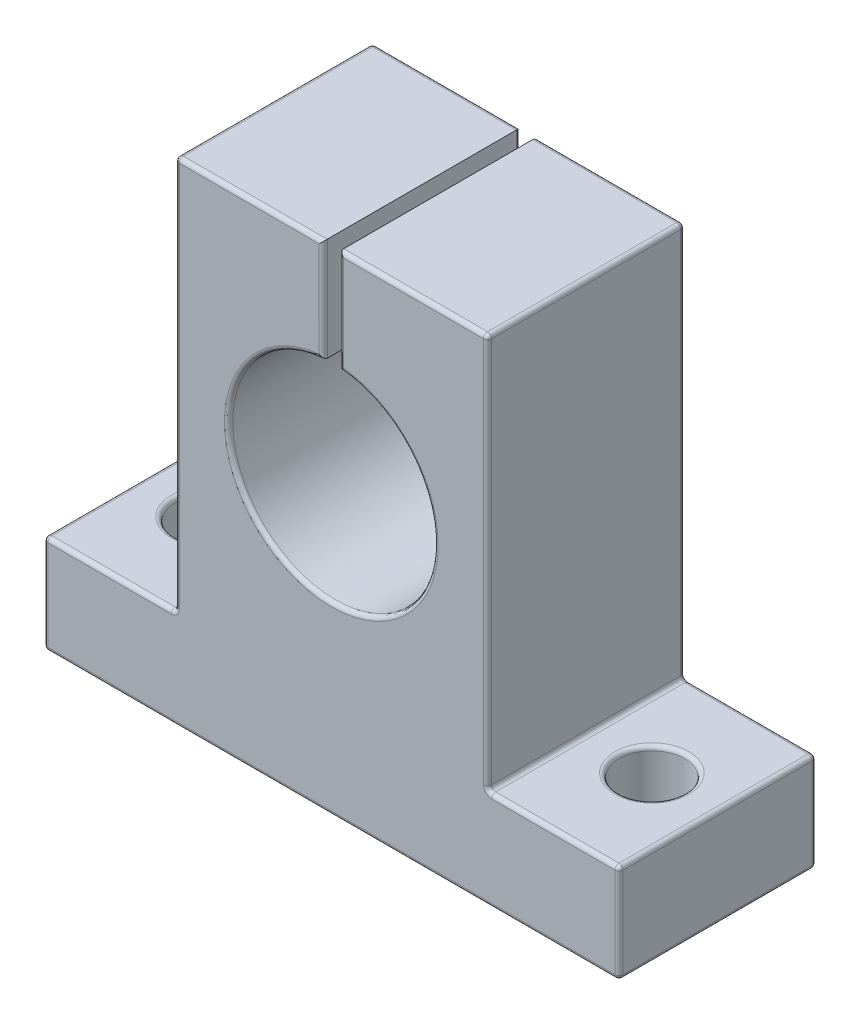
from build123d import *

# Parameters (mm, degrees)
DODANIE_WYCI_GNI_CIE1_DEPTH      = 12
DODANIE_WYCI_GNI_CIE1_DEPTH_BACK = 12
WYTNIJ_WYCI_GNI_CIE1_REACH       = 62.605
SZKIC2_R                         = 4
ZAOKR_GLENIE1_R                  = 0.5


with BuildPart() as part:
    # Szkic1 → Dodanie-wyciągnięcie1 (new, two sides: drawn at the far end of the back side and taken through both)
    with BuildSketch(Plane.XY.offset(-DODANIE_WYCI_GNI_CIE1_DEPTH_BACK)):
        with BuildLine():
            Line((19, 25), (19, -23))
            Line((19, -23), (35, -23))
            Line((35, -23), (35, -35))
            Line((35, -35), (-35, -35))
            Line((-35, -35), (-35, -23))
            Line((-35, -23), (-19, -23))
            Line((-19, -23), (-19, 25))
            Line((-19, 25), (-1, 25))
            Line((-1, 25), (-1, 12.459935794))
            ThreePointArc((-1, 12.459935794), (0, -12.5), (1, 12.459935794))
            Line((1, 12.459935794), (1, 25))
            Line((1, 25), (19, 25))
        make_face()
    extrude(amount=DODANIE_WYCI_GNI_CIE1_DEPTH + DODANIE_WYCI_GNI_CIE1_DEPTH_BACK)

    # Szkic2 → Wytnij-wyciągnięcie1 (cut, up to next)
    with BuildSketch(Plane(origin=(0, -23, 0), x_dir=(1, 0, 0), z_dir=(0, 1, 0)), mode=Mode.PRIVATE) as wytnij_wyci_gni_cie1_sk1:
        with Locations((27, 0)):
            Circle(SZKIC2_R)
    wytnij_wyci_gni_cie1_tool1 = extrude(wytnij_wyci_gni_cie1_sk1.sketch, amount=-WYTNIJ_WYCI_GNI_CIE1_REACH, mode=Mode.PRIVATE) & part.part
    wytnij_wyci_gni_cie1 = wytnij_wyci_gni_cie1_tool1.solids().sort_by_distance((27, -23, 0))[0]
    add(wytnij_wyci_gni_cie1, mode=Mode.SUBTRACT)

    # Lustro1: Wytnij-wyciągnięcie1 across plane
    add(wytnij_wyci_gni_cie1.mirror(Plane(origin=(0, 0, 0), x_dir=(0, 0, 1), z_dir=(1, 0, 0))), mode=Mode.SUBTRACT)

    # Zaokrąglenie1
    zaokr_glenie1_edges = [part.edges().sort_by_distance(p)[0] for p in [
        (-35, -35, 0),
        (-19, 25, 0),
        (-19, -23, 0),
        (-35, -23, 0),
        (-23, -23, 0),
        (10, 25, -12),
        (1, 18.729967897, -12),
        (0, -12.5, -12),
        (-1, 18.729967897, -12),
        (-10, 25, -12),
        (-19, 1, -12),
        (-27, -23, -12),
        (-35, -29, -12),
        (0, -35, -12),
        (35, -29, -12),
        (35, -35, 0),
        (27, -23, -12),
        (35, -23, 0),
        (23, -23, 0),
        (19, 1, -12),
        (19, -23, 0),
        (19, 25, 0),
        (-35, -29, 12),
        (-27, -23, 12),
        (-19, 1, 12),
        (-10, 25, 12),
        (-1, 18.729967897, 12),
        (0, -12.5, 12),
        (1, 18.729967897, 12),
        (10, 25, 12),
        (19, 1, 12),
        (27, -23, 12),
        (35, -29, 12),
        (0, -35, 12),
    ]]
    fillet(zaokr_glenie1_edges, radius=ZAOKR_GLENIE1_R)


solid = part.part
